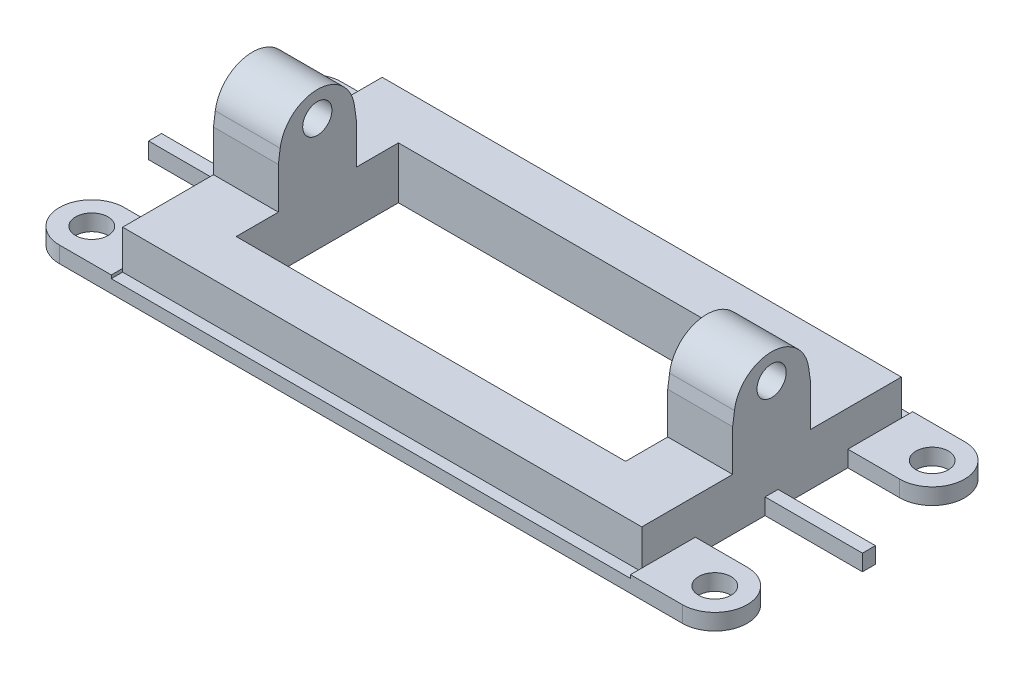
from build123d import *

# Parameters (mm, degrees)
SKETCH1_R               = 2.25
BOSS_EXTRUDE1_DEPTH     = 40
SKETCH3_R               = 2.5
SKETCH3_W               = 15
SKETCH3_H               = 2
BOSS_EXTRUDE2_DEPTH     = 2.5
CUT_EXTRUDE2_DEPTH      = 60
CUT_EXTRUDE2_DEPTH_BACK = 60
SKETCH2_W               = 60
SKETCH2_H               = 25


with BuildPart() as part:
    # Sketch1 → Boss-Extrude1 (new, symmetric)
    with BuildSketch(Plane(origin=(0, 0, 0), x_dir=(0, 0, -1), z_dir=(1, 0, 0))):
        with BuildLine():
            Line((-20, -2.671875), (-21.75, -2.671875))
            Line((-21.75, -2.671875), (-21.75, -4.671875))
            Line((-21.75, -4.671875), (21.75, -4.671875))
            Line((21.75, -4.671875), (21.75, -2.671875))
            Line((21.75, -2.671875), (20, -2.671875))
            Line((20, -2.671875), (20, 3.328125))
            Line((20, 3.328125), (10.652726064, 3.328125))
            Line((10.652726064, 3.328125), (6, 3.328125))
            Line((6, 3.328125), (6, 9.701246493))
            Line((6, 9.701246493), (5.721159773, 11.716861618))
            ThreePointArc((5.721159773, 11.716861618), (0, 16.70104227), (-5.721159773, 11.716861618))
            Line((-5.721159773, 11.716861618), (-6, 9.701246493))
            Line((-6, 9.701246493), (-6, 3.328125))
            Line((-6, 3.328125), (-10.652726064, 3.328125))
            Line((-10.652726064, 3.328125), (-20, 3.328125))
            Line((-20, 3.328125), (-20, -2.671875))
        make_face()
        with Locations((0, 12.828125)):
            Circle(SKETCH1_R, mode=Mode.SUBTRACT)
    extrude(amount=BOSS_EXTRUDE1_DEPTH, both=True)

    # Sketch3 → Boss-Extrude2 (add)
    # profile 1 of 6: a face of its own
    with BuildSketch(Plane(origin=(0, -4.671875, 0), x_dir=(1, 0, 0), z_dir=(0, 1, 0))):
        with BuildLine():
            Line((-40, 21.75), (-48, 21.75))
            ThreePointArc((-48, 21.75), (-53, 16.75), (-48, 11.75))
            Line((-48, 11.75), (-40, 11.75))
            Line((-40, 11.75), (-40, 21.75))
        make_face()
        with Locations(Location((-48, 16.75, 0), (0, 0, 270))):
            Circle(SKETCH3_R, mode=Mode.SUBTRACT)
    # profile 2 of 6: a face of its own
    with BuildSketch(Plane(origin=(0, -4.671875, 0), x_dir=(1, 0, 0), z_dir=(0, 1, 0))):
        with BuildLine():
            Line((40, 21.75), (48, 21.75))
            ThreePointArc((48, 21.75), (53, 16.75), (48, 11.75))
            Line((48, 11.75), (40, 11.75))
            Line((40, 11.75), (40, 21.75))
        make_face()
        with Locations(Location((48, 16.75, 0), (0, 0, 90))):
            Circle(SKETCH3_R, mode=Mode.SUBTRACT)
    # profile 3 of 6: a face of its own
    with BuildSketch(Plane(origin=(0, -4.671875, 0), x_dir=(1, 0, 0), z_dir=(0, 1, 0))):
        with BuildLine():
            Line((40, -21.75), (40, -11.75))
            Line((40, -11.75), (48, -11.75))
            ThreePointArc((48, -11.75), (53, -16.75), (48, -21.75))
            Line((48, -21.75), (40, -21.75))
        make_face()
        with Locations(Location((48, -16.75, 0), (0, 0, 270))):
            Circle(SKETCH3_R, mode=Mode.SUBTRACT)
    # profile 4 of 6: a face of its own
    with BuildSketch(Plane(origin=(0, -4.671875, 0), x_dir=(1, 0, 0), z_dir=(0, 1, 0))):
        with BuildLine():
            Line((-40, -21.75), (-48, -21.75))
            ThreePointArc((-48, -21.75), (-53, -16.75), (-48, -11.75))
            Line((-48, -11.75), (-40, -11.75))
            Line((-40, -11.75), (-40, -21.75))
        make_face()
        with Locations(Location((-48, -16.75, 0), (0, 0, 90))):
            Circle(SKETCH3_R, mode=Mode.SUBTRACT)
    # profile 5 of 6: a face of its own
    with BuildSketch(Plane(origin=(0, -4.671875, 0), x_dir=(1, 0, 0), z_dir=(0, 1, 0))):
        with Locations((-47.5, 0)):
            Rectangle(SKETCH3_W, SKETCH3_H)
    # profile 6 of 6: a face of its own
    with BuildSketch(Plane(origin=(0, -4.671875, 0), x_dir=(1, 0, 0), z_dir=(0, 1, 0))):
        with Locations((47.5, 0)):
            Rectangle(SKETCH3_W, SKETCH3_H)
    extrude(amount=BOSS_EXTRUDE2_DEPTH)

    # Sketch2 → Cut-Extrude2 (cut, two sides: drawn at the far end of the back side and taken through both)
    with BuildSketch(Plane(origin=(0, -2.671875, 0), x_dir=(1, 0, 0), z_dir=(0, 1, 0)).offset(-CUT_EXTRUDE2_DEPTH_BACK)):
        Rectangle(SKETCH2_W, SKETCH2_H)
    extrude(amount=CUT_EXTRUDE2_DEPTH + CUT_EXTRUDE2_DEPTH_BACK, mode=Mode.SUBTRACT)


solid = part.part
